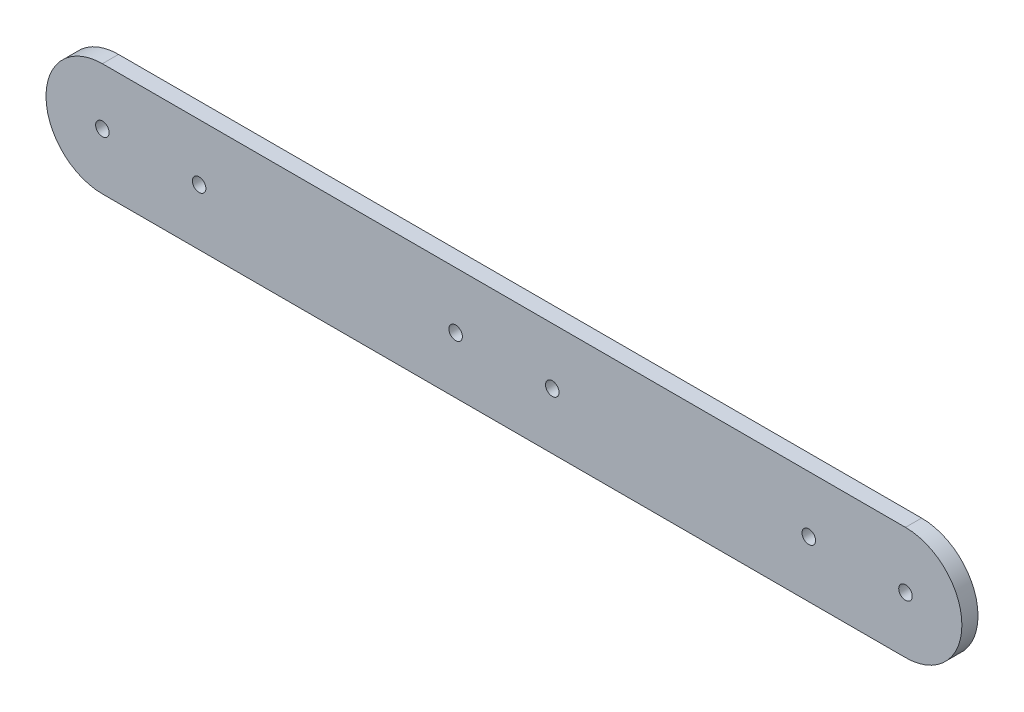
from build123d import *

# Parameters (mm, degrees)
SKETCH1_R           = 2.1
BOSS_EXTRUDE1_DEPTH = 5


with BuildPart() as part:
    # Sketch1 → Boss-Extrude1 (new body)
    with BuildSketch(Plane.XY):
        with BuildLine():
            Line((51.628885754, 99.200000001), (300.816905308, 99.200000001))
            ThreePointArc((300.816905308, 99.200000001), (318.316905308, 81.700000001), (300.816905308, 64.200000001))
            Line((300.816905308, 64.200000001), (51.628885754, 64.200000001))
            ThreePointArc((51.628885754, 64.200000001), (34.128885754, 81.700000001), (51.628885754, 99.200000001))
        make_face()
        with Locations((300.816905308, 81.700000001)):
            Circle(SKETCH1_R, mode=Mode.SUBTRACT)
        with Locations((270.816905308, 81.700000001)):
            Circle(SKETCH1_R, mode=Mode.SUBTRACT)
        with Locations((191.222895531, 81.700000001)):
            Circle(SKETCH1_R, mode=Mode.SUBTRACT)
        with Locations((51.628885754, 81.700000001)):
            Circle(SKETCH1_R, mode=Mode.SUBTRACT)
        with Locations((81.628885754, 81.700000001)):
            Circle(SKETCH1_R, mode=Mode.SUBTRACT)
        with Locations((161.222895531, 81.700000001)):
            Circle(SKETCH1_R, mode=Mode.SUBTRACT)
    extrude(amount=BOSS_EXTRUDE1_DEPTH)


solid = part.part
